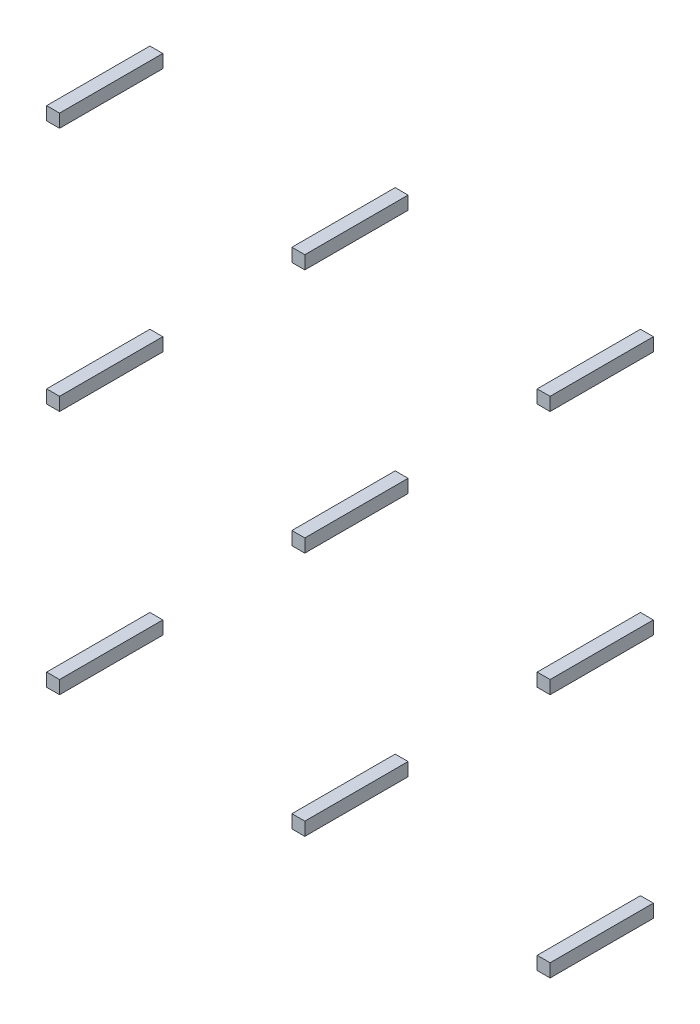
from build123d import *

# Parameters (mm, degrees)
SKETCH1_W           = 0.5
SKETCH1_H           = 0.511592571
BOSS_EXTRUDE1_DEPTH = 4
LPATTERN3_COUNT     = 3
LPATTERN3_PITCH     = 9.5
LPATTERN3_2_COUNT   = 3
LPATTERN3_2_PITCH   = 9.5


with BuildPart() as part:
    # Sketch1 → Boss-Extrude1 (new body)
    with BuildSketch(Plane.XY):
        with Locations((9.75, -9.244203714)):
            Rectangle(SKETCH1_W, SKETCH1_H)
    extrude(amount=BOSS_EXTRUDE1_DEPTH)


with BuildPart() as lpattern3_1:
    # LPattern3: pattern copy
    add(part.part.moved(Location(Vector(-1, 0, 0) * (1 * LPATTERN3_PITCH))))


with BuildPart() as lpattern3_2:
    # LPattern3: pattern copy
    add(part.part.moved(Location(Vector(-1, 0, 0) * (2 * LPATTERN3_PITCH))))


with BuildPart() as lpattern3_2_1:
    # LPattern3 2: pattern copy
    add(part.part.moved(Location(Vector(0, 1, 0) * (1 * LPATTERN3_2_PITCH))))


with BuildPart() as lpattern3_2_2:
    # LPattern3 2: pattern copy
    add(part.part.moved(Location(Vector(0, 1, 0) * (2 * LPATTERN3_2_PITCH))))


with BuildPart() as lpattern3_2_3:
    # LPattern3 2: pattern copy
    add(lpattern3_1.part.moved(Location(Vector(0, 1, 0) * (1 * LPATTERN3_2_PITCH))))


with BuildPart() as lpattern3_2_4:
    # LPattern3 2: pattern copy
    add(lpattern3_1.part.moved(Location(Vector(0, 1, 0) * (2 * LPATTERN3_2_PITCH))))


with BuildPart() as lpattern3_2_5:
    # LPattern3 2: pattern copy
    add(lpattern3_2.part.moved(Location(Vector(0, 1, 0) * (1 * LPATTERN3_2_PITCH))))


with BuildPart() as lpattern3_2_6:
    # LPattern3 2: pattern copy
    add(lpattern3_2.part.moved(Location(Vector(0, 1, 0) * (2 * LPATTERN3_2_PITCH))))


solid = Compound([part.part, lpattern3_1.part, lpattern3_2.part, lpattern3_2_1.part, lpattern3_2_2.part, lpattern3_2_3.part, lpattern3_2_4.part, lpattern3_2_5.part, lpattern3_2_6.part])
